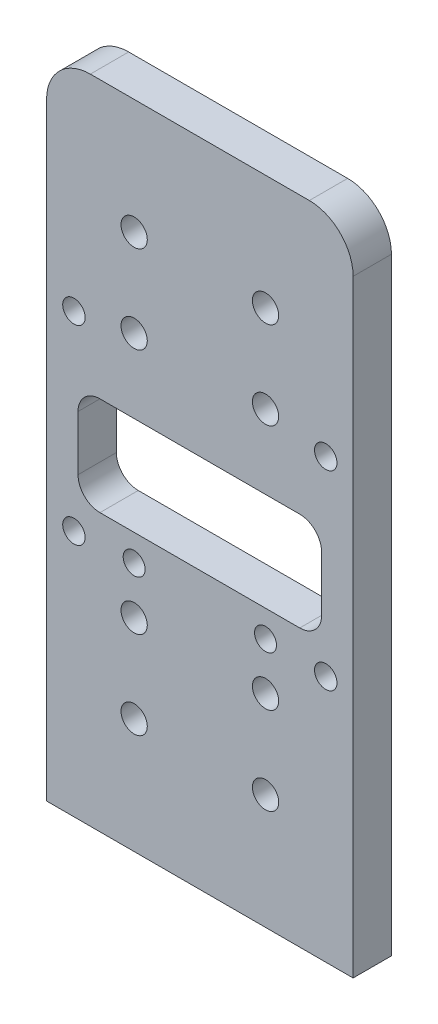
from build123d import *

# Parameters (mm, degrees)
BOSS_EXTRU_1_DEPTH      = 3.5
ESQUISSE2_R             = 1.2
ESQUISSE2_R_2           = 1.025
ENL_V_MAT_EXTRU_1_DEPTH = 66.852107028
ENL_V_MAT_EXTRU_2_DEPTH = 66.852107028
ESQUISSE7_R             = 1
ENL_V_MAT_EXTRU_4_DEPTH = 66.852107028


with BuildPart() as part:
    # Esquisse1 → Boss.-Extru.1 (new body)
    with BuildSketch(Plane.XY):
        with BuildLine():
            Line((0, 0), (28, 0))
            Line((28, 0), (28, 55.5))
            ThreePointArc((28, 55.5), (26.828427125, 58.328427125), (24, 59.5))
            Line((24, 59.5), (4, 59.5))
            ThreePointArc((4, 59.5), (1.171572875, 58.328427125), (0, 55.5))
            Line((0, 55.5), (0, 0))
        make_face()
    extrude(amount=BOSS_EXTRU_1_DEPTH)

    # Esquisse2 → Enlèv. mat.-Extru.1 (cut, through all)
    with BuildSketch(Plane.XY.offset(3.5)):
        with Locations((8, 10.5)):
            Circle(ESQUISSE2_R)
        with Locations((20, 10.5)):
            Circle(ESQUISSE2_R)
        with Locations((8, 18.5)):
            Circle(ESQUISSE2_R)
        with Locations((20, 18.5)):
            Circle(ESQUISSE2_R)
        with Locations((8, 49)):
            Circle(ESQUISSE2_R)
        with Locations((8, 41)):
            Circle(ESQUISSE2_R)
        with Locations((20, 49)):
            Circle(ESQUISSE2_R)
        with Locations((20, 41)):
            Circle(ESQUISSE2_R)
        with Locations((2.5, 40)):
            Circle(ESQUISSE2_R_2)
        with Locations((2.5, 22.6)):
            Circle(ESQUISSE2_R_2)
        with Locations((25.5, 40)):
            Circle(ESQUISSE2_R_2)
        with Locations((25.5, 22.6)):
            Circle(ESQUISSE2_R_2)
    extrude(amount=-ENL_V_MAT_EXTRU_1_DEPTH, mode=Mode.SUBTRACT)

    # Esquisse3 → Enlèv. mat.-Extru.2 (cut, through all)
    with BuildSketch(Plane.XY.offset(3.5)):
        with BuildLine():
            Line((4.875, 34.25), (23.125, 34.25))
            ThreePointArc((23.125, 34.25), (24.539213562, 33.664213562), (25.125, 32.25))
            Line((25.125, 32.25), (25.125, 27.25))
            ThreePointArc((25.125, 27.25), (24.539213562, 25.835786438), (23.125, 25.25))
            Line((23.125, 25.25), (4.875, 25.25))
            ThreePointArc((4.875, 25.25), (3.460786438, 25.835786438), (2.875, 27.25))
            Line((2.875, 27.25), (2.875, 32.25))
            ThreePointArc((2.875, 32.25), (3.460786438, 33.664213562), (4.875, 34.25))
        make_face()
    extrude(amount=-ENL_V_MAT_EXTRU_2_DEPTH, mode=Mode.SUBTRACT)

    # Esquisse7 → Enlèv. mat.-Extru.4 (cut, through all)
    with BuildSketch(Plane.XY.offset(3.5)):
        with Locations((8, 22.82)):
            Circle(ESQUISSE7_R)
        with Locations((20, 22.82)):
            Circle(ESQUISSE7_R)
    extrude(amount=-ENL_V_MAT_EXTRU_4_DEPTH, mode=Mode.SUBTRACT)


solid = part.part
